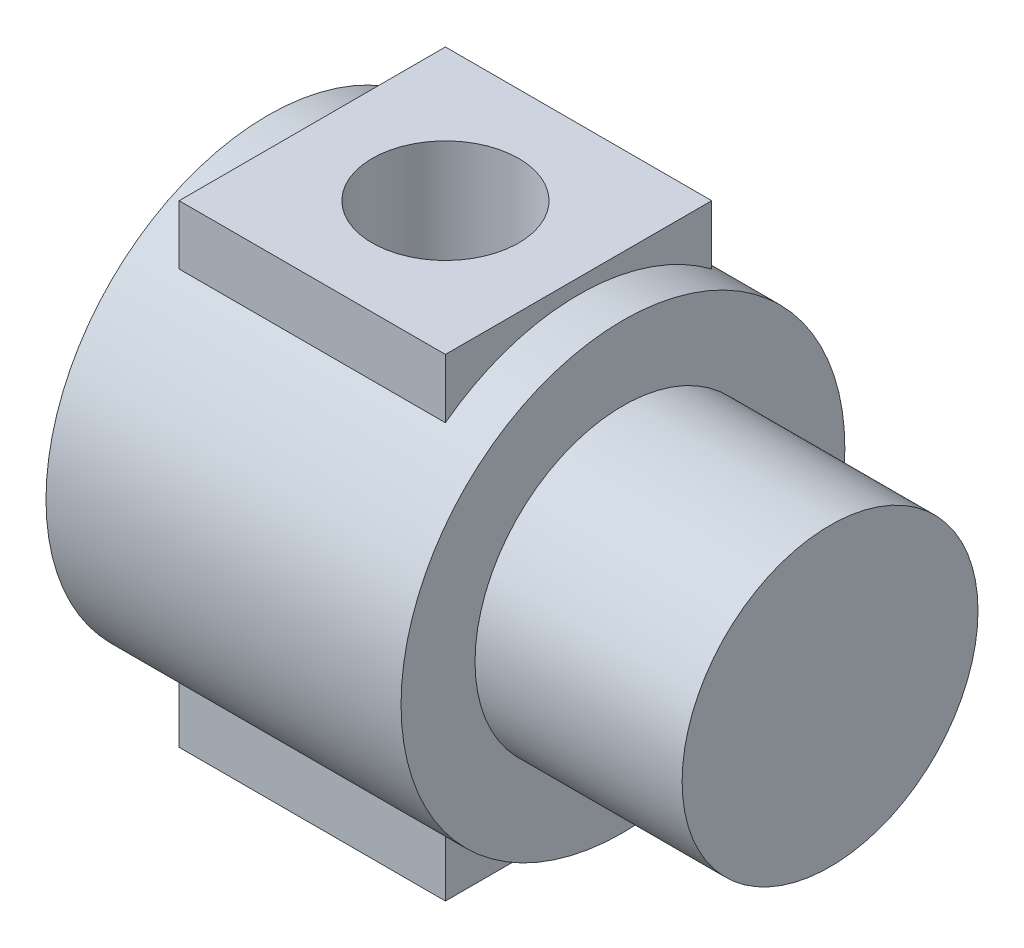
from build123d import *

# Parameters (mm, degrees)
SIDE_BOSS_SKETCH_W      = 18
SIDE_BOSS_SKETCH_H      = 16
SIDE_BOSS_DEPTH         = 9
SIDE_BOSS_2_SKETCH_W    = 18
SIDE_BOSS_2_SKETCH_H    = 16
SIDE_BOSS_2_DEPTH       = 9
BOTTOM_PORT_SKETCH_W    = 11.5
BOTTOM_PORT_SKETCH_H    = 4.953
SIDE_PORT_SKETCH_W      = 4.953
SIDE_PORT_SKETCH_H      = 11.5
SIDE_PASSAGE_SKETCH_W   = 2
SIDE_PASSAGE_SKETCH_H   = 5.5
SIDE_PORT_2_SKETCH_W    = 4.953
SIDE_PORT_2_SKETCH_H    = 11.5
SIDE_PASSAGE_2_SKETCH_W = 2
SIDE_PASSAGE_2_SKETCH_H = 5.5


with BuildPart() as part:
    # Reg_Outlet_Adapter Sketch → Reg_Outlet_Adapter (revolve)
    with BuildSketch(Plane.XY):
        Polygon((14, 0), (14, 10), (0, 10), (0, 15), (-24, 15), (-24, 0), align=None)
    revolve(axis=Axis((-1000, 0, 0), (1, 0, 0)))

    # Side Boss Sketch → Side Boss (add, symmetric)
    with BuildSketch(Plane.XY):
        with Locations((-12, 8)):
            Rectangle(SIDE_BOSS_SKETCH_W, SIDE_BOSS_SKETCH_H)
    extrude(amount=SIDE_BOSS_DEPTH, both=True)

    # Side Boss 2 Sketch → Side Boss 2 (add, symmetric)
    with BuildSketch(Plane.XY):
        with Locations((-12, -8)):
            Rectangle(SIDE_BOSS_2_SKETCH_W, SIDE_BOSS_2_SKETCH_H)
    extrude(amount=SIDE_BOSS_2_DEPTH, both=True)

    # Bottom Port Sketch → Bottom Port (revolve, cut)
    with BuildSketch(Plane.XY):
        with Locations((-19.25, 2.4765)):
            Rectangle(BOTTOM_PORT_SKETCH_W, BOTTOM_PORT_SKETCH_H)
    revolve(axis=Axis((-1000, 0, 0), (1, 0, 0)), mode=Mode.SUBTRACT)

    # Side Port Sketch → Side Port (revolve, cut)
    with BuildSketch(Plane.XY):
        with Locations((-9.5235, 11.25)):
            Rectangle(SIDE_PORT_SKETCH_W, SIDE_PORT_SKETCH_H)
    revolve(axis=Axis((-12, -60, 0), (0, 1, 0)), mode=Mode.SUBTRACT)

    # Side Passage Sketch → Side Passage (revolve, cut)
    with BuildSketch(Plane.XY):
        with Locations((-11, 2.75)):
            Rectangle(SIDE_PASSAGE_SKETCH_W, SIDE_PASSAGE_SKETCH_H)
    revolve(axis=Axis((-12, -60, 0), (0, 1, 0)), mode=Mode.SUBTRACT)

    # Side Port 2 Sketch → Side Port 2 (revolve, cut)
    with BuildSketch(Plane.XY):
        with Locations((-9.5235, -11.25)):
            Rectangle(SIDE_PORT_2_SKETCH_W, SIDE_PORT_2_SKETCH_H)
    revolve(axis=Axis((-12, -60, 0), (0, 1, 0)), mode=Mode.SUBTRACT)

    # Side Passage 2 Sketch → Side Passage 2 (revolve, cut)
    with BuildSketch(Plane.XY):
        with Locations((-11, -2.75)):
            Rectangle(SIDE_PASSAGE_2_SKETCH_W, SIDE_PASSAGE_2_SKETCH_H)
    revolve(axis=Axis((-12, -60, 0), (0, 1, 0)), mode=Mode.SUBTRACT)


solid = part.part
